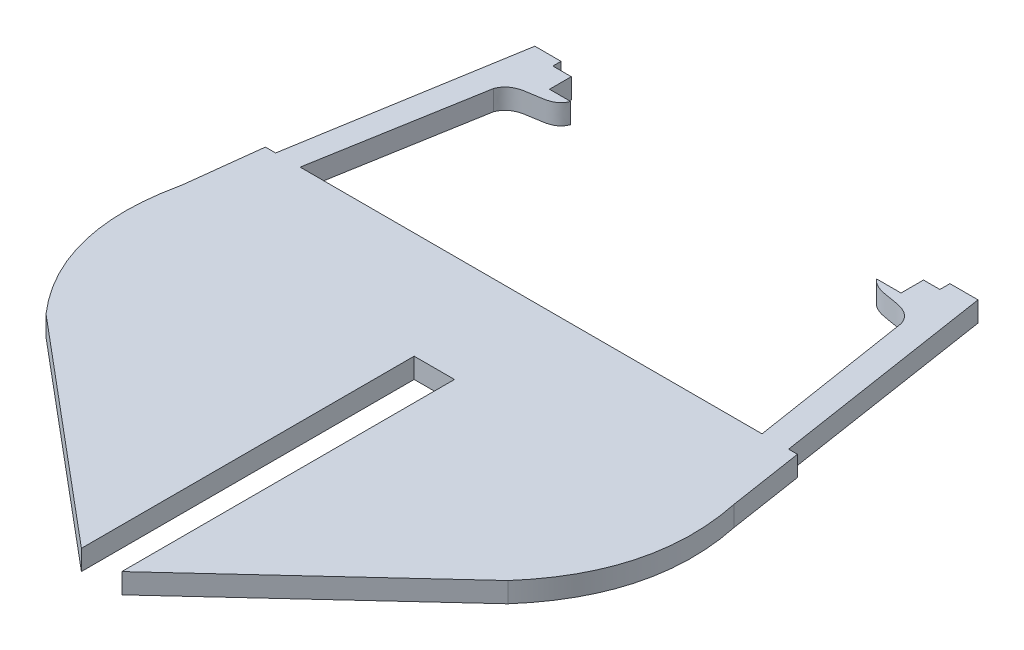
from build123d import *

# Parameters (mm, degrees)
EXTRUDE_1_DEPTH = 4


with BuildPart() as part:
    # 草图1 → 凸台-拉伸1 (new body)
    with BuildSketch(Plane(origin=(0, 0, 0), x_dir=(1, 0, 0), z_dir=(0, 1, 0))):
        with BuildLine():
            Line((-68.113865549, -204.589037385), (-70.41129412, -189.723323099))
            Line((-70.41129412, -189.723323099), (-72.168151263, -189.723323099))
            Line((-72.168151263, -189.723323099), (-79.035402442, -145.288168411))
            Line((-79.035402442, -145.288168411), (-84.60129412, -145.288168411))
            Line((-84.60129412, -145.288168411), (-84.60129412, -147.288465956))
            Line((-84.60129412, -147.288465956), (-87.844722691, -147.288465956))
            Line((-87.844722691, -147.288465956), (-87.844722691, -151.748180242))
            Line((-87.844722691, -151.748180242), (-92.709865549, -151.748180242))
            add(Edge.make_bspline(
                [(-92.709865549, -151.748180242), (-90.010717894, -155.009209908), (-84.138050482, -152.326043307), (-82.574151263, -157.01875167)],
                knots=[0, 0, 0, 0, 1, 1, 1, 1], degree=3))
            Line((-82.574151263, -157.01875167), (-77.438722691, -189.723323099))
            Line((-77.438722691, -189.723323099), (-169.065579834, -189.723323099))
            Line((-169.065579834, -189.723323099), (-163.389579834, -157.01875167))
            add(Edge.make_bspline(
                [(-153.524151263, -151.613037385), (-155.104728125, -155.721980391), (-161.603046346, -152.481116628), (-163.389579834, -157.01875167)],
                knots=[0, 0, 0, 0, 1, 1, 1, 1], degree=3))
            Line((-153.524151263, -151.613037385), (-157.713579834, -151.613037385))
            Line((-157.713579834, -151.613037385), (-157.713579834, -147.288465956))
            Line((-157.713579834, -147.288465956), (-161.362436977, -147.288465956))
            Line((-161.362436977, -147.288465956), (-161.362436977, -145.66675167))
            Line((-161.362436977, -145.66675167), (-166.561192779, -145.66675167))
            Line((-166.561192779, -145.66675167), (-173.930722691, -189.723323099))
            Line((-173.930722691, -189.723323099), (-175.957865549, -189.723323099))
            Line((-175.957865549, -189.723323099), (-177.714722691, -204.589037385))
            add(Edge.make_bspline(
                [(-177.714722691, -204.589037385), (-182.218975988, -224.983917638), (-169.065579834, -240.131608813)],
                knots=[0, 0, 0, 1, 1, 1], degree=2))
            Line((-169.065579834, -240.131608813), (-125.27929412, -276.890465956))
            Line((-125.27929412, -276.890465956), (-125.27929412, -210.890465956))
            Line((-125.27929412, -210.890465956), (-117.27929412, -210.890465956))
            Line((-117.27929412, -210.890465956), (-117.27929412, -276.890465956))
            Line((-117.27929412, -276.890465956), (-77.438722691, -240.131608813))
            add(Edge.make_bspline(
                [(-68.113865549, -204.589037385), (-63.867281147, -224.729251643), (-77.438722691, -240.131608813)],
                knots=[0, 0, 0, 1, 1, 1], degree=2))
        make_face()
    extrude(amount=EXTRUDE_1_DEPTH)


solid = part.part
